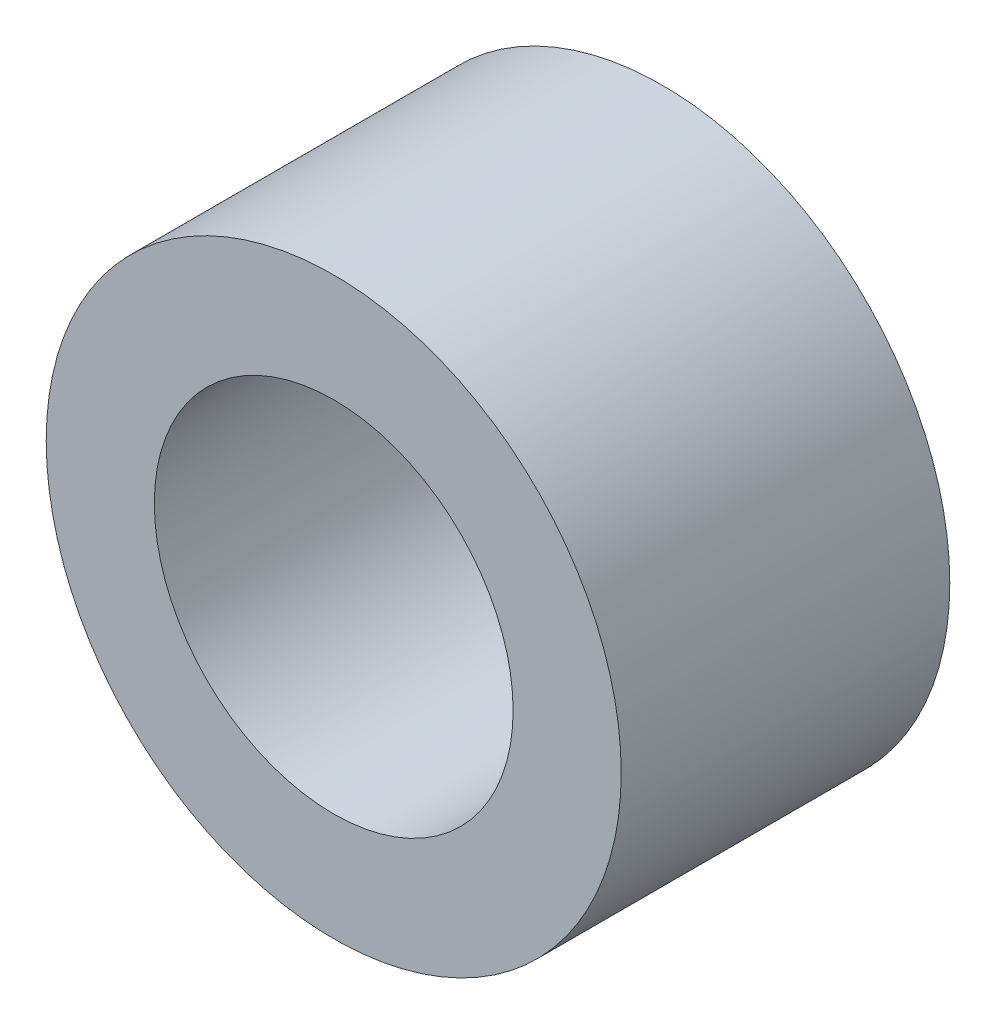
from build123d import *

# Parameters (mm, degrees)
SKETCH1_R           = 11.1125
SKETCH1_R_2         = 6.9342
BOSS_EXTRUDE1_DEPTH = 12.7


with BuildPart() as part:
    # Sketch1 → Boss-Extrude1 (new body)
    with BuildSketch(Plane.XY):
        Circle(SKETCH1_R)
        Circle(SKETCH1_R_2, mode=Mode.SUBTRACT)
    extrude(amount=BOSS_EXTRUDE1_DEPTH)


solid = part.part
